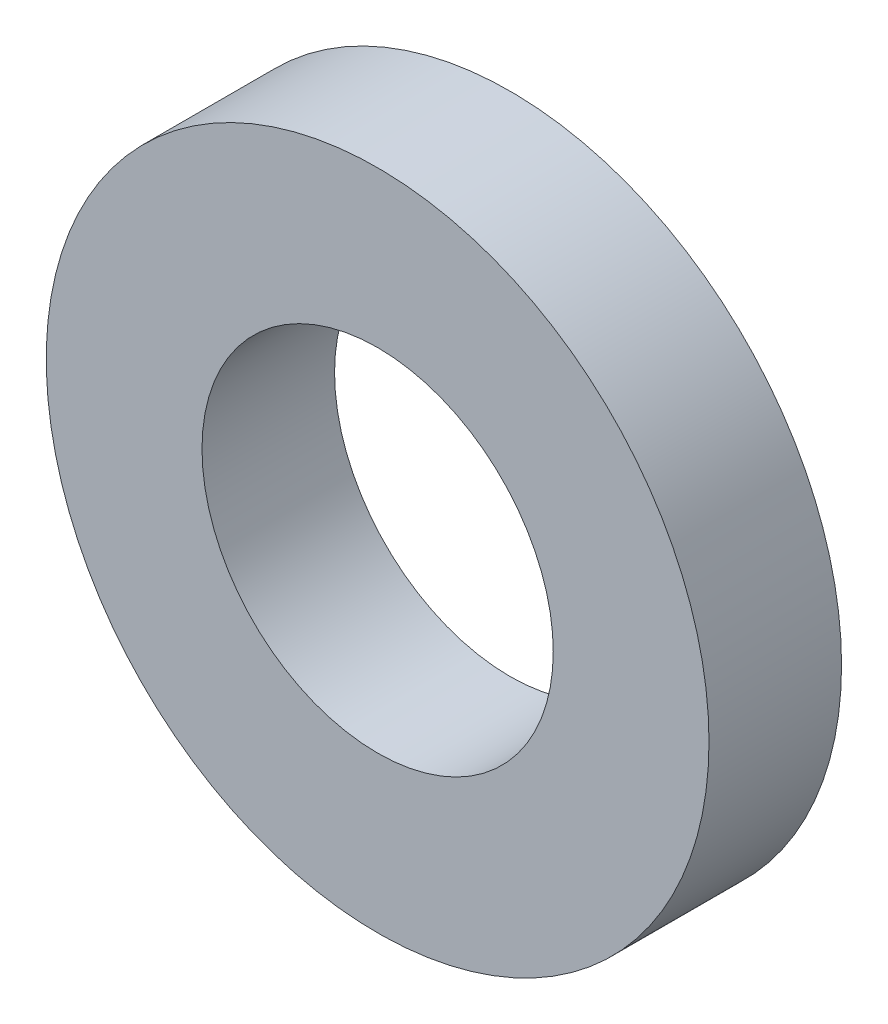
from build123d import *

# Parameters (mm, degrees)
SKETCH_1_R      = 5
SKETCH_1_R_2    = 2.65
EXTRUDE_1_DEPTH = 2


with BuildPart() as part:
    # 草图1 → 凸台-拉伸1 (new body)
    with BuildSketch(Plane.XY):
        Circle(SKETCH_1_R)
        Circle(SKETCH_1_R_2, mode=Mode.SUBTRACT)
    extrude(amount=EXTRUDE_1_DEPTH)


solid = part.part
